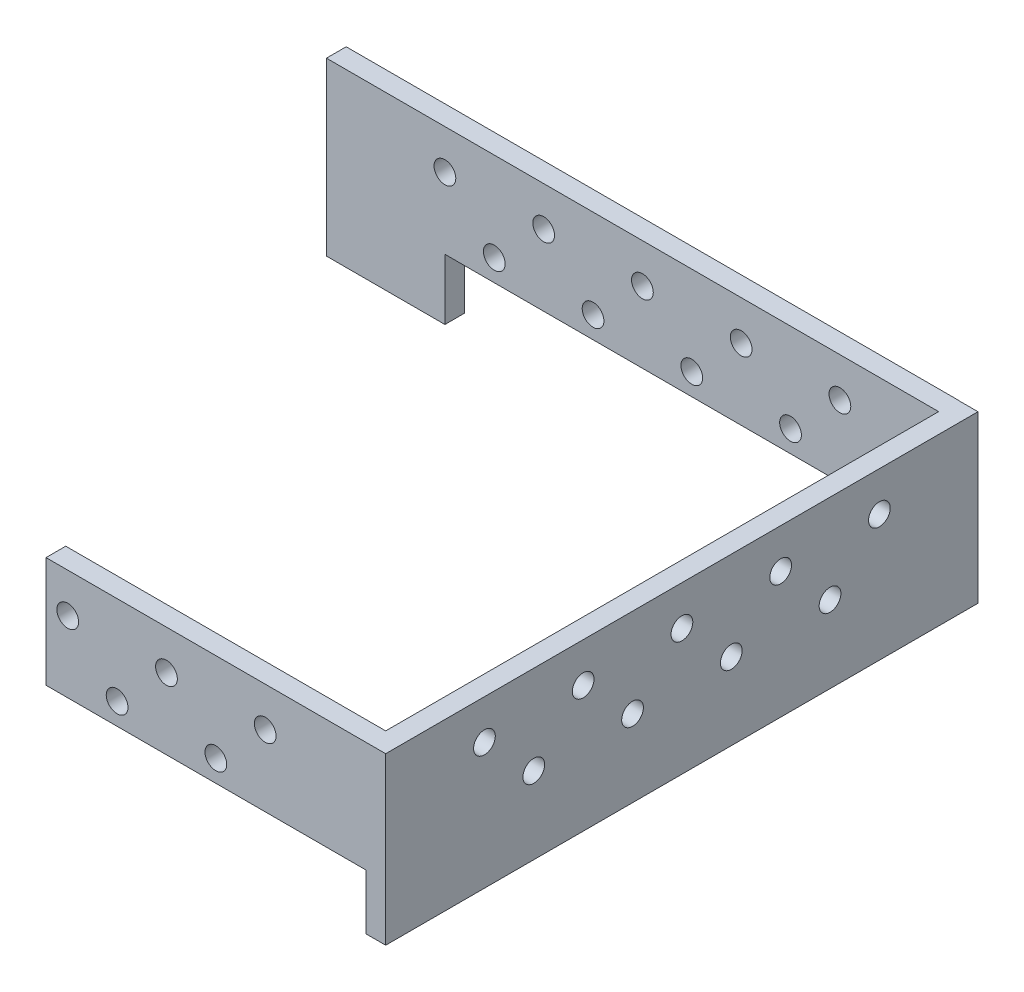
from build123d import *

# Parameters (mm, degrees)
SKETCH1_W                      = 42
SKETCH1_H                      = 145.161285219
BOSS_EXTRUDE1_DEPTH            = 5
BOSS_EXTRUDE2_DEPTH            = 5
SKETCH3_W                      = 5
SKETCH3_H                      = 27.999999523
BOSS_EXTRUDE3_DEPTH            = 81.000003815
F_5_5_5_5_DIAMETER_HOLE1_D     = 5.5
F_5_5_5_5_DIAMETER_HOLE2_D     = 5.5
F_5_5_5_5_DIAMETER_HOLE2_DEPTH = 5
F_5_5_5_5_DIAMETER_HOLE3_D     = 5.5
F_5_5_5_5_DIAMETER_HOLE3_DEPTH = 5
SKETCH10_W                     = 5
SKETCH10_H                     = 42
BOSS_EXTRUDE4_DEPTH            = 4.8


with BuildPart() as part:
    # Sketch1 → Boss-Extrude1 (new body)
    with BuildSketch(Plane(origin=(-5, 0, 0), x_dir=(0, -1, 0), z_dir=(-1, 0, 0))):
        with Locations((21, -72.58064261)):
            Rectangle(SKETCH1_W, SKETCH1_H)
    extrude(amount=-BOSS_EXTRUDE1_DEPTH)

    # Sketch2 → Boss-Extrude2 (add)
    with BuildSketch(Plane(origin=(0, 0, -150), x_dir=(-1, 0, 0), z_dir=(0, 0, -1))):
        Polygon((130, -43.400001526), (160, -43.400001526), (160, 0), (5, 0), (5, -27.999999523), (130, -27.999999523), align=None)
    extrude(amount=-BOSS_EXTRUDE2_DEPTH)

    # Sketch3 → Boss-Extrude3 (add)
    with BuildSketch(Plane.ZY.offset(5)):
        with Locations((-2.5, -13.999999762)):
            Rectangle(SKETCH3_W, SKETCH3_H)
    extrude(amount=BOSS_EXTRUDE3_DEPTH)

    # Ø5.5 (5.5) Diameter Hole1 (through all)
    with Locations(Plane.ZY.offset(5)):
        with Locations((-37.500000596, -22.500000199), (-25.000000199, -9.99999995), (-50.000000795, -9.99999995), (-62.500000795, -22.500000199), (-75.000000795, -9.99999995), (-87.500000795, -22.500000199), (-112.500000795, -22.500000199), (-100.000000795, -9.99999995), (-125.000000795, -9.99999995)):
            Hole(F_5_5_5_5_DIAMETER_HOLE1_D / 2)

    # Ø5.5 (5.5) Diameter Hole2
    with Locations(Plane.XY.offset(-145)):
        with Locations((-30.000000199, -9.99999995), (-42.500000397, -22.500000199), (-67.500000795, -22.500000199), (-55.000000795, -9.99999995), (-80.000001192, -9.99999995), (-92.500000795, -22.500000199), (-117.500000795, -22.500000199), (-105.000000795, -9.99999995), (-130.000003179, -9.99999995)):
            Hole(F_5_5_5_5_DIAMETER_HOLE2_D / 2, depth=F_5_5_5_5_DIAMETER_HOLE2_DEPTH)

    # Ø5.5 (5.5) Diameter Hole3
    with Locations(Plane(origin=(0, 0, -5), x_dir=(-1, 0, 0), z_dir=(0, 0, -1))):
        with Locations((80.50000151, -9.99999995), (68.000001113, -22.500000199), (43.000001113, -22.500000199), (55.500001113, -9.99999995), (30.500000119, -9.99999995)):
            Hole(F_5_5_5_5_DIAMETER_HOLE3_D / 2, depth=F_5_5_5_5_DIAMETER_HOLE3_DEPTH)

    # Sketch10 → Boss-Extrude4 (add)
    with BuildSketch(Plane(origin=(0, 0, -145.161285219), x_dir=(-1, 0, 0), z_dir=(0, 0, -1))):
        with Locations((2.5, -21)):
            Rectangle(SKETCH10_W, SKETCH10_H)
    extrude(amount=BOSS_EXTRUDE4_DEPTH)


solid = part.part
